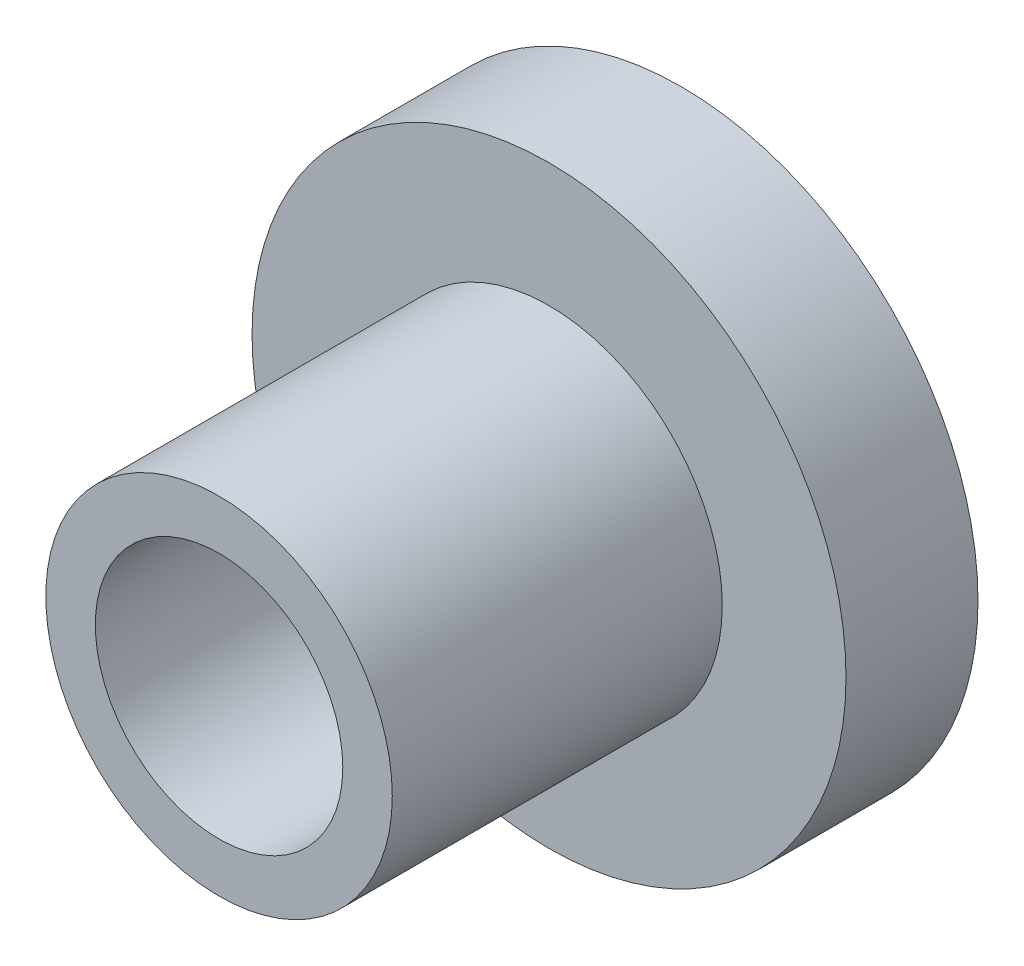
from build123d import *

# Parameters (mm, degrees)
SKETCH1_R           = 4.5
SKETCH1_R_2         = 1.875
BOSS_EXTRUDE1_DEPTH = 2
SKETCH2_R           = 2.625
SKETCH2_R_2         = 1.875
BOSS_EXTRUDE2_DEPTH = 5


with BuildPart() as part:
    # Sketch1 → Boss-Extrude1 (new body)
    with BuildSketch(Plane.XY):
        Circle(SKETCH1_R)
        Circle(SKETCH1_R_2, mode=Mode.SUBTRACT)
    extrude(amount=BOSS_EXTRUDE1_DEPTH)

    # Sketch2 → Boss-Extrude2 (add)
    with BuildSketch(Plane.XY.offset(2)):
        Circle(SKETCH2_R)
        Circle(SKETCH2_R_2, mode=Mode.SUBTRACT)
    extrude(amount=BOSS_EXTRUDE2_DEPTH)


solid = part.part
